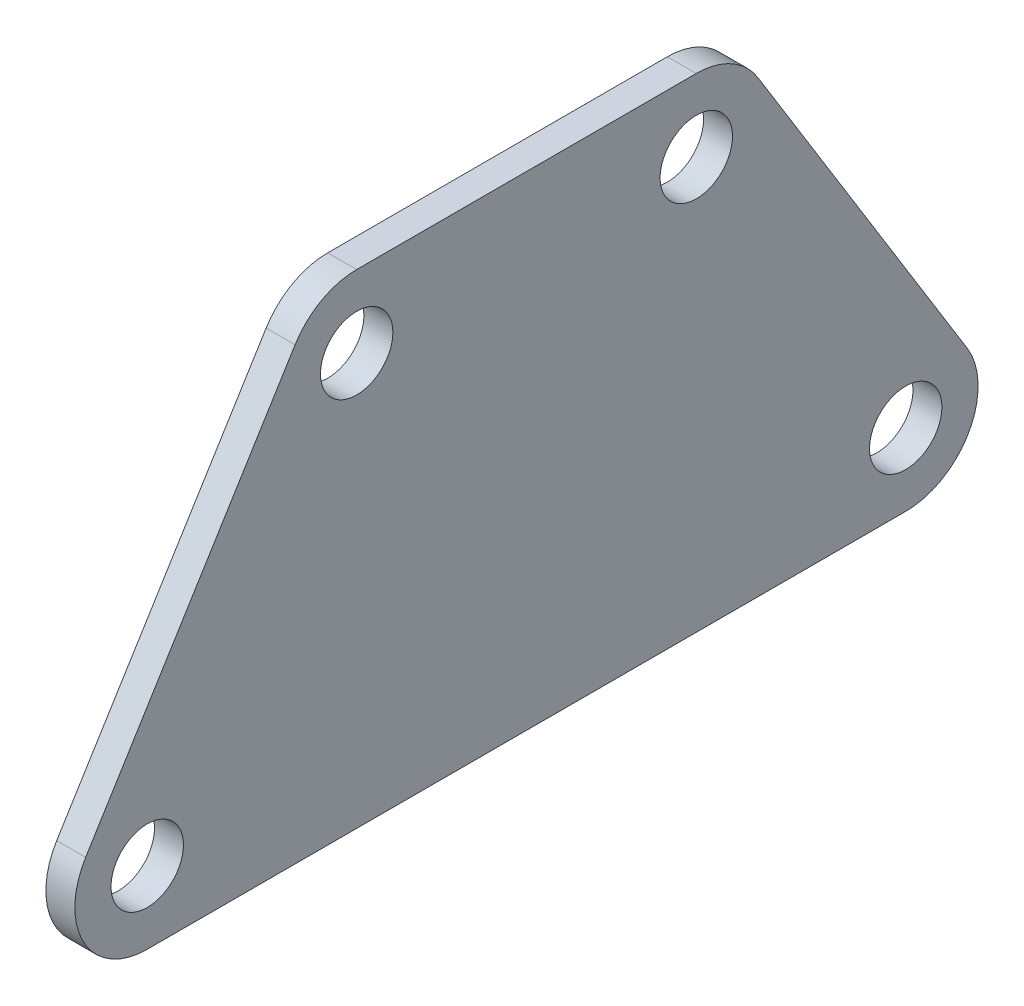
from build123d import *

# Parameters (mm, degrees)
SKETCH1_R           = 5
BOSS_EXTRUDE1_DEPTH = 4


with BuildPart() as part:
    # Sketch1 → Boss-Extrude1 (new body)
    with BuildSketch(Plane(origin=(0, 0, 0), x_dir=(0, 0, -1), z_dir=(1, 0, 0))):
        with BuildLine():
            Line((-36.606792803, 46.127358491), (10.310393651, 46.127358491))
            ThreePointArc((10.310393651, 46.127358491), (15.182052827, 44.860452837), (18.819325493, 41.380745865))
            Line((18.819325493, 41.380745865), (47.747278282, -5.473971116))
            ThreePointArc((47.747278282, -5.473971116), (47.971440787, -15.599017667), (39.23834644, -20.727358491))
            Line((39.23834644, -20.727358491), (-65.534745592, -20.727358491))
            ThreePointArc((-65.534745592, -20.727358491), (-74.267839938, -15.599017667), (-74.043677434, -5.473971116))
            Line((-74.043677434, -5.473971116), (-45.115724645, 41.380745865))
            ThreePointArc((-45.115724645, 41.380745865), (-41.478451979, 44.860452837), (-36.606792803, 46.127358491))
        make_face()
        with Locations((-36.606792803, 36.127358491)):
            Circle(SKETCH1_R, mode=Mode.SUBTRACT)
        with Locations((10.310393651, 36.127358491)):
            Circle(SKETCH1_R, mode=Mode.SUBTRACT)
        with Locations((39.23834644, -10.727358491)):
            Circle(SKETCH1_R, mode=Mode.SUBTRACT)
        with Locations((-65.534745592, -10.727358491)):
            Circle(SKETCH1_R, mode=Mode.SUBTRACT)
    extrude(amount=BOSS_EXTRUDE1_DEPTH)


solid = part.part
